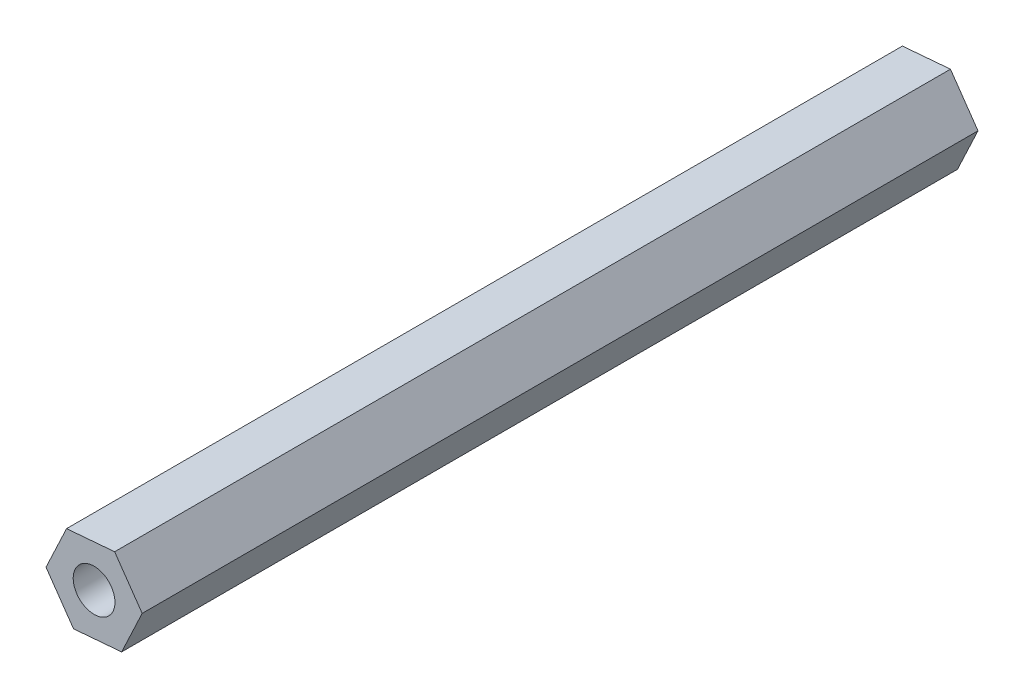
from build123d import *

# Parameters (mm, degrees)
EXTRUDE_1_DEPTH    = 50
HOLE_WIZARD_M3_1_D = 2.5


with BuildPart() as part:
    # 草图1 → 凸台-拉伸1 (new body)
    with BuildSketch(Plane.XY):
        Polygon((1.647343323, -2.37056814), (2.876643893, 0.241357097), (1.229300569, 2.611925237), (-1.647343323, 2.37056814), (-2.876643893, -0.241357097), (-1.229300569, -2.611925237), align=None)
    extrude(amount=EXTRUDE_1_DEPTH)

    # M3 螺纹孔1 (through all)
    with Locations(Plane(origin=(0, 0, 0), x_dir=(-1, 0, 0), z_dir=(0, 0, -1))):
        with Locations((0, 0)):
            Hole(HOLE_WIZARD_M3_1_D / 2)


solid = part.part
